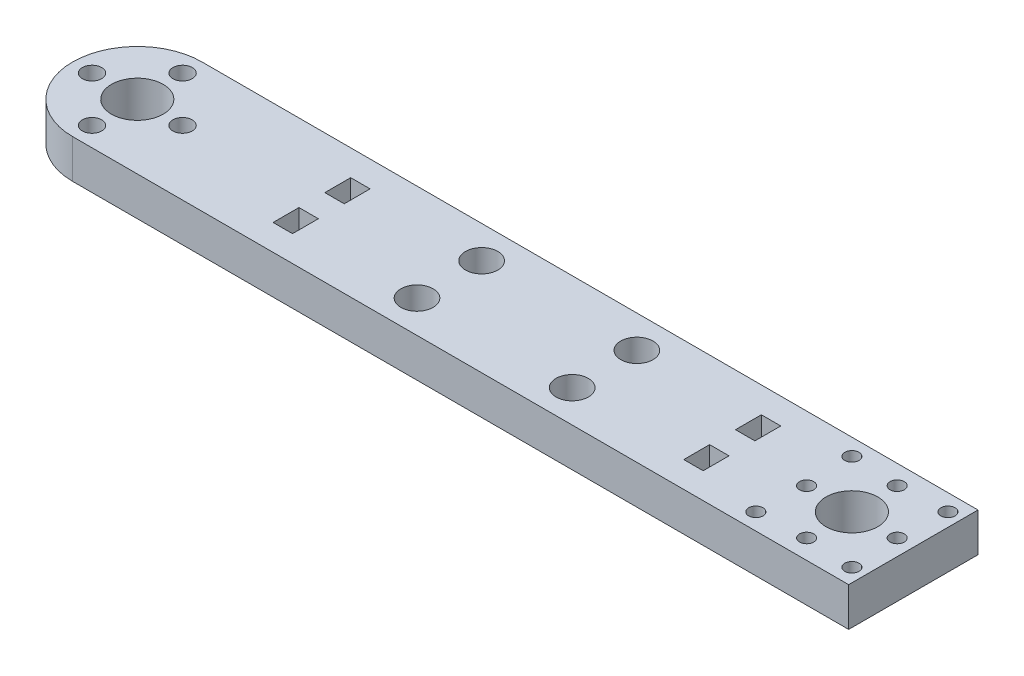
from build123d import *

# Parameters (mm, degrees)
EXTRUDE_1_DEPTH     = 6
SKETCH_2_R          = 1.5
SKETCH_2_R_2        = 4
CUT_EXTRUDE_1_DEPTH = 10
SKETCH_3_W          = 3
SKETCH_3_H          = 4
CUT_EXTRUDE_2_DEPTH = 10
SKETCH_4_R          = 4
SKETCH_4_R_2        = 1.1
SKETCH_4_W          = 3
SKETCH_4_H          = 4
CUT_EXTRUDE_4_DEPTH = 10
SKETCH_5_R          = 2.5
CUT_EXTRUDE_5_DEPTH = 10


with BuildPart() as part:
    # 草图1 → 凸台-拉伸1 (new body)
    with BuildSketch(Plane(origin=(0, 0, 0), x_dir=(1, 0, 0), z_dir=(0, 1, 0))):
        with BuildLine():
            Line((-41.199983302, 20), (78.800016698, 20))
            Line((78.800016698, 20), (78.800016698, 0))
            Line((78.800016698, 0), (-41.199983302, 0))
            ThreePointArc((-41.199983302, 0), (-51.199983302, 10), (-41.199983302, 20))
        make_face()
    extrude(amount=EXTRUDE_1_DEPTH)

    # 草图2 → 切除-拉伸1 (cut)
    with BuildSketch(Plane(origin=(0, 6, 0), x_dir=(1, 0, 0), z_dir=(0, 1, 0))):
        with Locations(Location((-48.199983302, 10, 0), (0, 0, 270))):
            Circle(SKETCH_2_R)
        with BuildLine():
            ThreePointArc((-39.699983302, 17), (-40.13932313, 18.060660172), (-41.199983302, 18.5))
            Line((-41.199983302, 18.5), (-41.199983302, 17))
            Line((-41.199983302, 17), (-41.199983302, 15.5))
            ThreePointArc((-41.199983302, 15.5), (-40.13932313, 15.939339828), (-39.699983302, 17))
        make_face()
        with BuildLine():
            Line((-41.199983302, 17), (-41.199983302, 18.5))
            ThreePointArc((-41.199983302, 18.5), (-42.699983302, 17), (-41.199983302, 15.5))
            Line((-41.199983302, 15.5), (-41.199983302, 17))
        make_face()
        with Locations(Location((-34.199983302, 10, 0), (0, 0, 270))):
            Circle(SKETCH_2_R)
        with BuildLine():
            ThreePointArc((-39.699983302, 3), (-40.13932313, 4.060660172), (-41.199983302, 4.5))
            Line((-41.199983302, 4.5), (-41.199983302, 3))
            Line((-41.199983302, 3), (-41.199983302, 1.5))
            ThreePointArc((-41.199983302, 1.5), (-40.13932313, 1.939339828), (-39.699983302, 3))
        make_face()
        with BuildLine():
            Line((-41.199983302, 3), (-41.199983302, 4.5))
            ThreePointArc((-41.199983302, 4.5), (-42.699983302, 3), (-41.199983302, 1.5))
            Line((-41.199983302, 1.5), (-41.199983302, 3))
        make_face()
        with Locations(Location((-41.199983302, 10, 0), (0, 0, 270))):
            Circle(SKETCH_2_R_2)
    extrude(amount=-CUT_EXTRUDE_1_DEPTH, mode=Mode.SUBTRACT)

    # 草图3 → 切除-拉伸2 (cut)
    with BuildSketch(Plane(origin=(0, 6, 0), x_dir=(1, 0, 0), z_dir=(0, 1, 0))):
        with Locations((-12.699983302, 14)):
            Rectangle(SKETCH_3_W, SKETCH_3_H)
        with Locations((-12.699983302, 6)):
            Rectangle(SKETCH_3_W, SKETCH_3_H)
    extrude(amount=-CUT_EXTRUDE_2_DEPTH, mode=Mode.SUBTRACT)

    # 草图4 → 切除-拉伸4 (cut)
    with BuildSketch(Plane(origin=(0, 6, 0), x_dir=(1, 0, 0), z_dir=(0, 1, 0))):
        with Locations(Location((69.300016698, 10, 0), (0, 0, 270))):
            Circle(SKETCH_4_R)
        with Locations(Location((76.7246379, 17.424621202, 0), (0, 0, 270))):
            Circle(SKETCH_4_R_2)
        with Locations(Location((62.300016698, 10, 0), (0, 0, 270))):
            Circle(SKETCH_4_R_2)
        with Locations((50.800016698, 6)):
            Rectangle(SKETCH_4_W, SKETCH_4_H)
        with Locations((50.800016698, 14)):
            Rectangle(SKETCH_4_W, SKETCH_4_H)
        with Locations(Location((76.7246379, 2.575378798, 0), (0, 0, 270))):
            Circle(SKETCH_4_R_2)
        with Locations(Location((61.875395496, 2.575378798, 0), (0, 0, 270))):
            Circle(SKETCH_4_R_2)
        with Locations(Location((61.875395496, 17.424621202, 0), (0, 0, 270))):
            Circle(SKETCH_4_R_2)
        with Locations(Location((69.300016698, 17, 0), (0, 0, 270))):
            Circle(SKETCH_4_R_2)
        with Locations(Location((76.300016698, 10, 0), (0, 0, 270))):
            Circle(SKETCH_4_R_2)
        with Locations(Location((69.300016698, 3, 0), (0, 0, 270))):
            Circle(SKETCH_4_R_2)
    extrude(amount=-CUT_EXTRUDE_4_DEPTH, mode=Mode.SUBTRACT)

    # 草图5 → 切除-拉伸5 (cut)
    with BuildSketch(Plane(origin=(0, 6, 0), x_dir=(1, 0, 0), z_dir=(0, 1, 0))):
        with Locations(Location((31.050016698, 15, 0), (0, 0, 270))):
            Circle(SKETCH_5_R)
        with Locations(Location((31.050016698, 5, 0), (0, 0, 270))):
            Circle(SKETCH_5_R)
        with Locations(Location((7.050016698, 15, 0), (0, 0, 270))):
            Circle(SKETCH_5_R)
        with Locations(Location((7.050016698, 5, 0), (0, 0, 270))):
            Circle(SKETCH_5_R)
    extrude(amount=-CUT_EXTRUDE_5_DEPTH, mode=Mode.SUBTRACT)


solid = part.part
